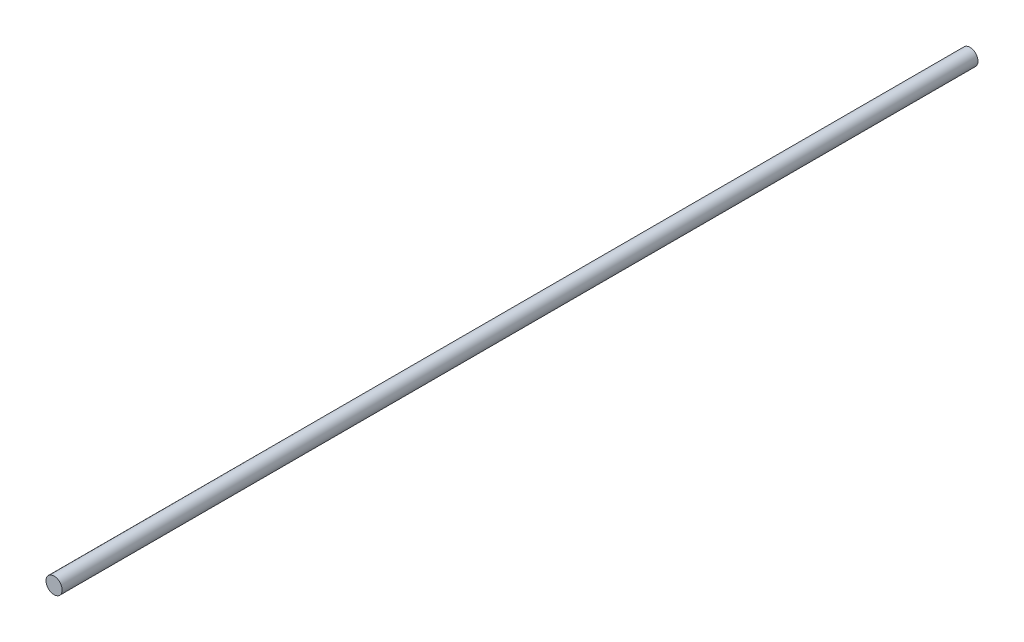
from build123d import *

# Parameters (mm, degrees)
ESQUISSE1_R        = 1.5
BOSS_EXTRU_1_DEPTH = 170


with BuildPart() as part:
    # Esquisse1 → Boss.-Extru.1 (new body)
    with BuildSketch(Plane.XY):
        Circle(ESQUISSE1_R)
    extrude(amount=BOSS_EXTRU_1_DEPTH)


solid = part.part
